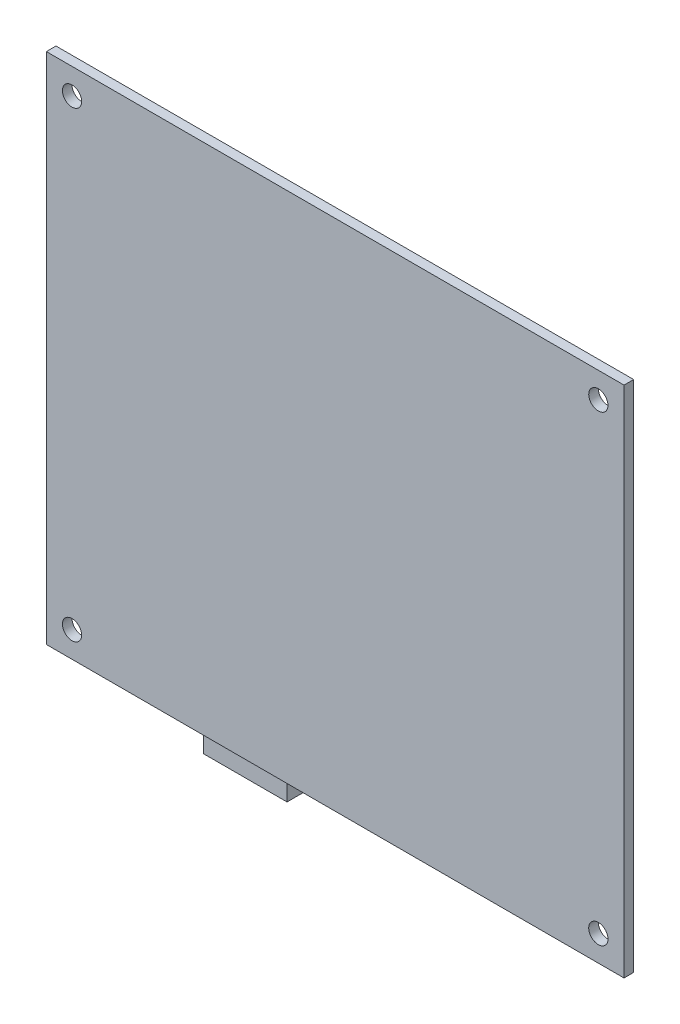
from build123d import *

# Parameters (mm, degrees)
SKETCH_1_W          = 90
SKETCH_1_H          = 80
SKETCH_1_R          = 1.5
EXTRUDE_1_DEPTH     = 1.5
SKETCH_2_W          = 13
SKETCH_2_H          = 8
EXTRUDE_2_DEPTH     = 4
SKETCH_3_W          = 13
SKETCH_3_H          = 8
SKETCH_3_W_2        = 10
SKETCH_3_H_2        = 12
EXTRUDE_3_DEPTH     = 15
SKETCH_4_R          = 1.762202075
SKETCH_4_R_2        = 1.721763756
CUT_EXTRUDE_1_DEPTH = 4


with BuildPart() as part:
    # 草图1 → 凸台-拉伸1 (new body)
    with BuildSketch(Plane.XY):
        with Locations((45, 40)):
            Rectangle(SKETCH_1_W, SKETCH_1_H)
        with Locations((4, 76)):
            Circle(SKETCH_1_R, mode=Mode.SUBTRACT)
        with Locations(Location((86, 76, 0), (0, 0, 180))):
            Circle(SKETCH_1_R, mode=Mode.SUBTRACT)
        with Locations((86, 4)):
            Circle(SKETCH_1_R, mode=Mode.SUBTRACT)
        with Locations(Location((4, 4, 0), (0, 0, 180))):
            Circle(SKETCH_1_R, mode=Mode.SUBTRACT)
    extrude(amount=EXTRUDE_1_DEPTH)



with BuildPart() as body_2:
    # 草图2 → 凸台-拉伸2 (new body)
    with BuildSketch(Plane.XZ):
        with Locations((29.5, -4)):
            Rectangle(SKETCH_2_W, SKETCH_2_H)
    extrude(amount=EXTRUDE_2_DEPTH)


with BuildPart() as part_1:
    add(part.part)

    add(body_2.part)  # 凸台-拉伸3 merges body 2
    # 草图3 → 凸台-拉伸3 (add)
    with BuildSketch(Plane(origin=(0, 0, 0), x_dir=(1, 0, 0), z_dir=(0, 1, 0))):
        with Locations((29.5, 4)):
            Rectangle(SKETCH_3_W, SKETCH_3_H)
        with Locations((15, 6)):
            Rectangle(SKETCH_3_W_2, SKETCH_3_H_2)
    extrude(amount=EXTRUDE_3_DEPTH)

    # 草图4 → 切除-拉伸1 (cut)
    with BuildSketch(Plane.XZ.offset(4)):
        Polygon((25.156072285, -1.21963674), (23.853575099, -2.522133926), (23.853575099, -5.586833186), (25.002837322, -6.736095409), (35.116344883, -6.736095409), (35.116344883, -1.21963674), align=None)
        with Locations(Location((26.611804434, -3.977866074, 0), (0, 0, 270))):
            Circle(SKETCH_4_R, mode=Mode.SUBTRACT)
        with Locations(Location((32.43473303, -3.977866074, 0), (0, 0, 270))):
            Circle(SKETCH_4_R_2, mode=Mode.SUBTRACT)
    extrude(amount=-CUT_EXTRUDE_1_DEPTH, mode=Mode.SUBTRACT)


solid = part_1.part
